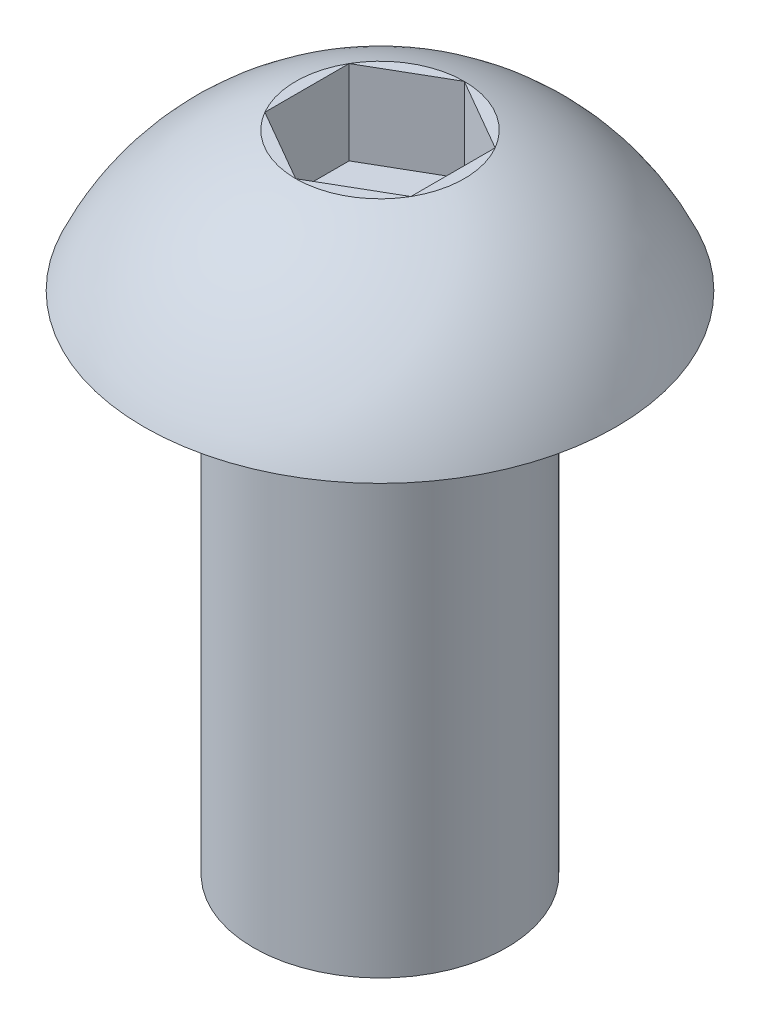
from build123d import *

# Parameters (mm, degrees)
SKETCH2_R           = 1.5
BOSS_EXTRUDE1_DEPTH = 6
CUT_EXTRUDE1_DEPTH  = 1


with BuildPart() as part:
    # Sketch1 → Revolve1 (revolve)
    with BuildSketch(Plane(origin=(0, 0, 0), x_dir=(0, 0, -1), z_dir=(1, 0, 0))):
        with BuildLine():
            Line((0, 0), (0, 1.65))
            Line((0, 1.65), (-1, 1.65))
            ThreePointArc((-1, 1.65), (-2.075469546, 1.016421323), (-2.8, 0))
            Line((-2.8, 0), (0, 0))
        make_face()
    revolve(axis=Axis((0, 4.725289413, 0), (0, -1, 0)))

    # Sketch2 → Boss-Extrude1 (add)
    with BuildSketch(Plane.XZ):
        with Locations(Location((0, 0, 0), (0, 0, 270))):
            Circle(SKETCH2_R)
    extrude(amount=BOSS_EXTRUDE1_DEPTH)

    # Sketch3 → Cut-Extrude1 (cut)
    with BuildSketch(Plane(origin=(0, 1.65, 0), x_dir=(1, 0, 0), z_dir=(0, 1, 0))):
        Polygon((0, 1), (-0.866025404, 0.5), (-0.866025404, -0.5), (0, -1), (0.866025404, -0.5), (0.866025404, 0.5), align=None)
    extrude(amount=-CUT_EXTRUDE1_DEPTH, mode=Mode.SUBTRACT)


solid = part.part
